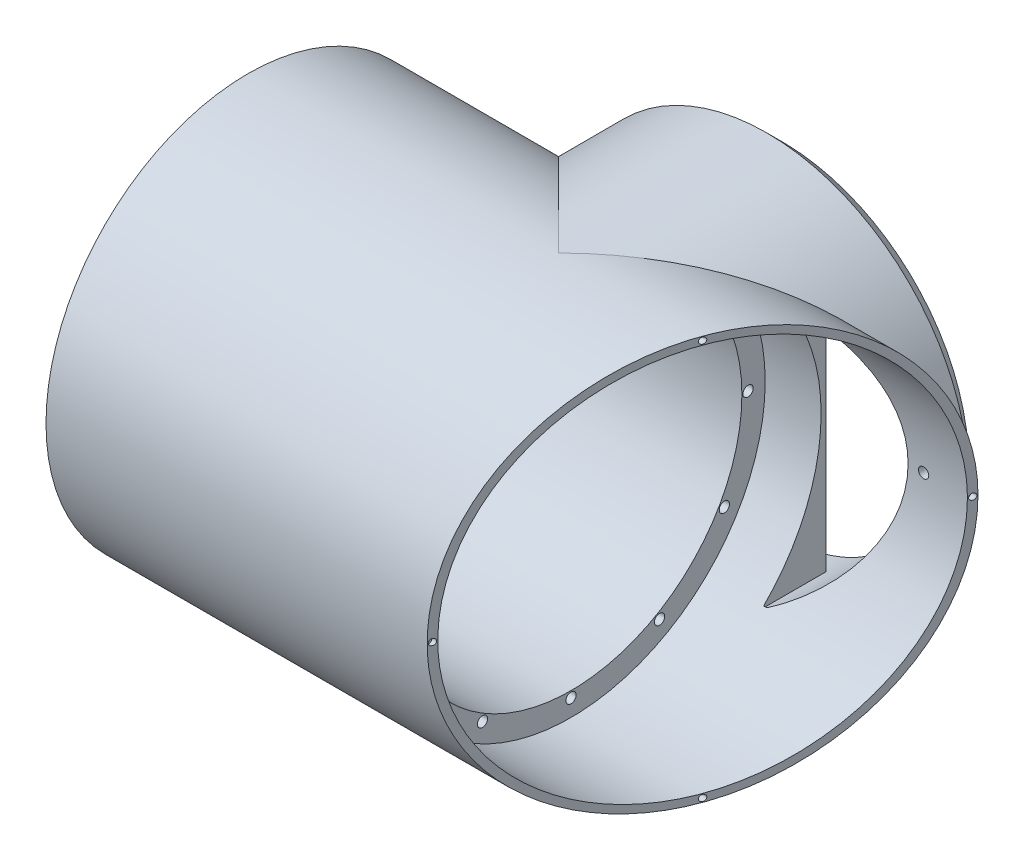
from build123d import *
from build123d.topology import SkipClean

# Parameters (mm, degrees)
SKETCH_1_R               = 65
EXTRUDE_1_DEPTH          = 72
EXTRUDE_2_DEPTH          = 70
EXTRUDE_2_DEPTH_BACK     = 100
SKETCH_2_R               = 65
SKETCH_3_R               = 45
CUT_EXTRUDE_1_DEPTH      = 228.802546079
CUT_EXTRUDE_3_DEPTH      = 182.642506039
CUT_EXTRUDE_3_DEPTH_BACK = 182.642506039
SKETCH_6_R               = 57.5
CUT_EXTRUDE_4_DEPTH      = 26
SKETCH_7_R               = 62.5
CUT_EXTRUDE_5_DEPTH      = 71
SKETCH_8_R               = 55
CUT_EXTRUDE_6_DEPTH      = 62
PATTERN_CIRCULAR_1_COUNT = 12
PATTERN_CIRCULAR_2_COUNT = 12
SKETCH_18_R              = 1
CUT_EXTRUDE_17_DEPTH     = 32
SKETCH_19_R              = 1
CUT_EXTRUDE_18_DEPTH     = 53
SKETCH_20_R              = 1
CUT_EXTRUDE_19_DEPTH     = 7
CHAMFER_3_SIZE           = 5
SKETCH_29_R              = 50
CUT_EXTRUDE_23_DEPTH     = 8
PATTERN_CIRCULAR_3_COUNT = 10
CUT_EXTRUDE_24_DEPTH     = 20


with BuildPart() as part:
    # 草图1 → 凸台-拉伸1 (new body)
    with BuildSketch(Plane.XY):
        Circle(SKETCH_1_R)
    extrude(amount=EXTRUDE_1_DEPTH)

    # 草图2 → 凸台-拉伸2 (add, two sides: drawn at the far end of the back side and taken through both)
    with BuildSketch(Plane(origin=(0, 0, 0), x_dir=(0, 0, -1), z_dir=(1, 0, 0)).offset(-EXTRUDE_2_DEPTH_BACK)):
        with Locations((-72, 0)):
            Circle(SKETCH_2_R)
    extrude(amount=EXTRUDE_2_DEPTH + EXTRUDE_2_DEPTH_BACK)

    # 草图3 → 切除-拉伸1 (cut, through all)
    with BuildSketch(Plane(origin=(70, 0, 0), x_dir=(0, 0, -1), z_dir=(1, 0, 0))):
        with Locations((-72, 0)):
            Circle(SKETCH_3_R)
    extrude(amount=-CUT_EXTRUDE_1_DEPTH, mode=Mode.SUBTRACT)

    # 草图5 → 切除-拉伸3 (cut, two sides: drawn at the far end of the back side and taken through both)
    with BuildSketch(Plane(origin=(0, 0, 0), x_dir=(1, 0, 0), z_dir=(0, 1, 0)).offset(-CUT_EXTRUDE_3_DEPTH_BACK)):
        Polygon((70, -7), (70, -137), (22.683869545, -137), align=None)
    extrude(amount=CUT_EXTRUDE_3_DEPTH + CUT_EXTRUDE_3_DEPTH_BACK, mode=Mode.SUBTRACT)

    # 草图6 → 切除-拉伸4 (cut)
    with BuildSketch(Plane.ZY.offset(100)):
        with Locations((72, 0)):
            Circle(SKETCH_6_R)
    extrude(amount=-CUT_EXTRUDE_4_DEPTH, mode=Mode.SUBTRACT)

    # 草图7 → 切除-拉伸5 (cut)
    with BuildSketch(Plane(origin=(75, 0, 0), x_dir=(0, 0, -1), z_dir=(1, 0, 0))):
        with Locations((-72, 0)):
            Circle(SKETCH_7_R)
    extrude(amount=-CUT_EXTRUDE_5_DEPTH, mode=Mode.SUBTRACT)

    # 草图8 → 切除-拉伸6 (cut)
    with BuildSketch(Plane(origin=(4, 0, 0), x_dir=(0, 0, -1), z_dir=(1, 0, 0))):
        with Locations((-72, 0)):
            Circle(SKETCH_8_R)
    extrude(amount=-CUT_EXTRUDE_6_DEPTH, mode=Mode.SUBTRACT)

    # 草图9 → M4 螺纹孔1 (revolve, cut)
    with BuildSketch(Plane(origin=(-74, 51, 72), x_dir=(0, 0, 1), z_dir=(0, 1, 0))):
        Polygon((0, 0), (0, 11.091420021), (1.65, 10.1), (1.65, 0), align=None)
    hole_wizard_m4_1 = revolve(axis=Axis((-80.35, 51, 72), (1, 0, 0)), mode=Mode.SUBTRACT)

    # 阵列(圆周)1: M4 螺纹孔1 ×12 about axis
    pattern_circular_1_axis = Axis((0, 0, 72), (1, 0, 0))
    for i in range(1, PATTERN_CIRCULAR_1_COUNT):
        add(hole_wizard_m4_1.rotate(pattern_circular_1_axis, i * 360 / PATTERN_CIRCULAR_1_COUNT), mode=Mode.SUBTRACT)

    # 草图11 → M4 螺纹孔2 (revolve, cut)
    with BuildSketch(Plane(origin=(4, 0, 129), x_dir=(0, 0, -1), z_dir=(0, 1, 0))):
        Polygon((0, 0), (0, 11.091420021), (1.65, 10.1), (1.65, 0), align=None)
    hole_wizard_m4_2 = revolve(axis=Axis((10.35, 0, 129), (-1, 0, 0)), mode=Mode.SUBTRACT)

    # 阵列(圆周)2: M4 螺纹孔2 ×12 about axis
    pattern_circular_2_axis = Axis((0, 0, 72), (1, 0, 0))
    for i in range(1, PATTERN_CIRCULAR_2_COUNT):
        add(hole_wizard_m4_2.rotate(pattern_circular_2_axis, i * 360 / PATTERN_CIRCULAR_2_COUNT), mode=Mode.SUBTRACT)

    # 草图18 → 切除-拉伸17 (cut)
    with BuildSketch(Plane(origin=(75, 0, 0), x_dir=(0, 0, -1), z_dir=(1, 0, 0))):
        with Locations((-72, 63.75)):
            Circle(SKETCH_18_R)
        with Locations((-72, -63.75)):
            Circle(SKETCH_18_R)
    extrude(amount=-CUT_EXTRUDE_17_DEPTH, mode=Mode.SUBTRACT)

    # 草图19 → 切除-拉伸18 (cut)
    with BuildSketch(Plane(origin=(75, 0, 0), x_dir=(0, 0, -1), z_dir=(1, 0, 0))):
        with Locations((-135.75, 0)):
            Circle(SKETCH_19_R)
    extrude(amount=-CUT_EXTRUDE_18_DEPTH, mode=Mode.SUBTRACT)

    # 草图20 → 切除-拉伸19 (cut)
    with BuildSketch(Plane(origin=(75, 0, 0), x_dir=(0, 0, -1), z_dir=(1, 0, 0))):
        with Locations((-8.25, 0)):
            Circle(SKETCH_20_R)
    extrude(amount=-CUT_EXTRUDE_19_DEPTH, mode=Mode.SUBTRACT)

    # 倒角3
    chamfer_3_edges = [part.edges().sort_by_distance(p)[0] for p in [
        (-65, 0, 0),
    ]]
    chamfer(chamfer_3_edges, length=CHAMFER_3_SIZE)

    # 草图27 → M4 螺纹孔4 (revolve, cut)
    with BuildSketch(Plane.YZ.offset(55)):
        Polygon((0, 0), (0, 11.091420021), (1.65, 10.1), (1.65, 0), align=None)
    hole_wizard_m4_4 = revolve(axis=Axis((55, 0, -6.35), (0, 0, 1)), mode=Mode.SUBTRACT)

    # 草图29 → 切除-拉伸23 (cut)
    with BuildSketch(Plane(origin=(0, 0, 0), x_dir=(-1, 0, 0), z_dir=(0, 0, -1))):
        Circle(SKETCH_29_R)
    extrude(amount=-CUT_EXTRUDE_23_DEPTH, mode=Mode.SUBTRACT)

    # 阵列(圆周)3: M4 螺纹孔4 ×10 about axis
    pattern_circular_3_axis = Axis((0, 0, 0), (0, 0, 1))
    for i in range(1, PATTERN_CIRCULAR_3_COUNT):
        add(hole_wizard_m4_4.rotate(pattern_circular_3_axis, i * 360 / PATTERN_CIRCULAR_3_COUNT), mode=Mode.SUBTRACT)

    # 草图30 → 切除-拉伸24 (cut)
    with SkipClean():  # the faces are left unmerged after this step: merging them gives an invalid solid
        with BuildSketch(Plane(origin=(0, 0, 8), x_dir=(-1, 0, 0), z_dir=(0, 0, -1))):
            with BuildLine():
                Line((-22, 44.899888641), (-22, -44.899888641))
                ThreePointArc((-22, -44.899888641), (-50, 0), (-22, 44.899888641))
            make_face()
        extrude(amount=-CUT_EXTRUDE_24_DEPTH, mode=Mode.SUBTRACT)


solid = part.part
